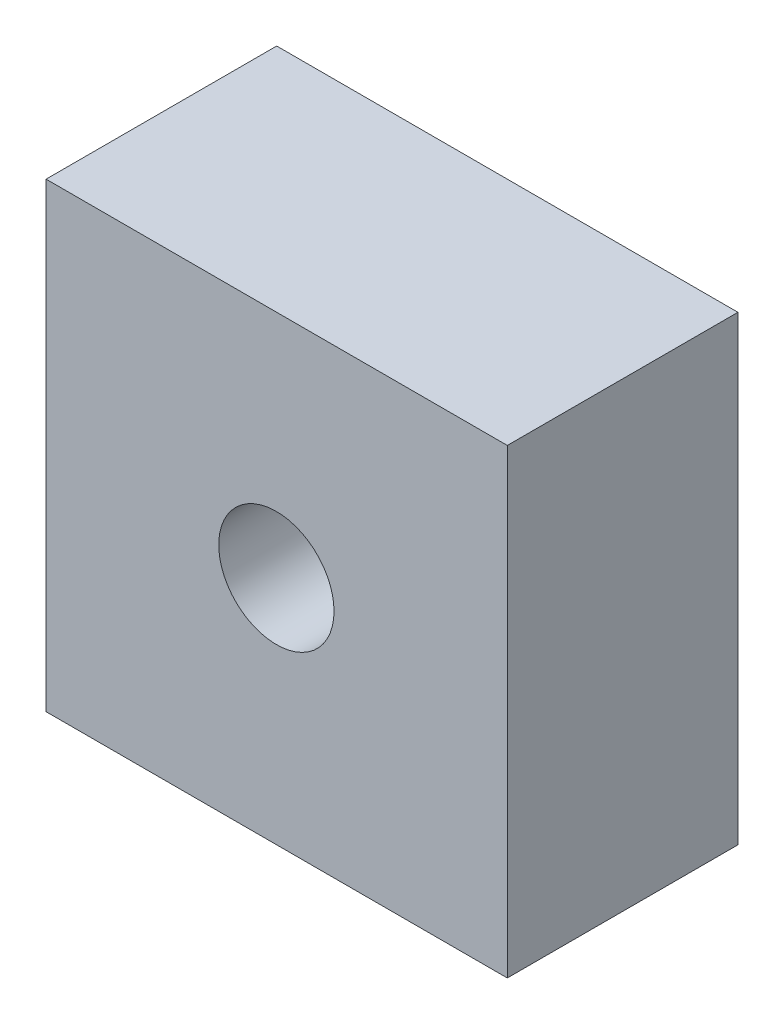
from build123d import *

# Parameters (mm, degrees)
SKETCH_1_W          = 20
SKETCH_1_H          = 20
BASEBOX_DEPTH       = 10
HOLE_WIZARD_1_D     = 5
HOLE_WIZARD_1_DEPTH = 5


with BuildPart() as part:
    # 草图1 → BaseBox (new body)
    with BuildSketch(Plane.XY):
        with Locations((10, 10)):
            Rectangle(SKETCH_1_W, SKETCH_1_H)
    extrude(amount=BASEBOX_DEPTH)

    # 孔1
    with Locations(Plane.XY.offset(10)):
        with Locations((9.986487375, 10.014305599)):
            Hole(HOLE_WIZARD_1_D / 2, depth=HOLE_WIZARD_1_DEPTH)


solid = part.part
